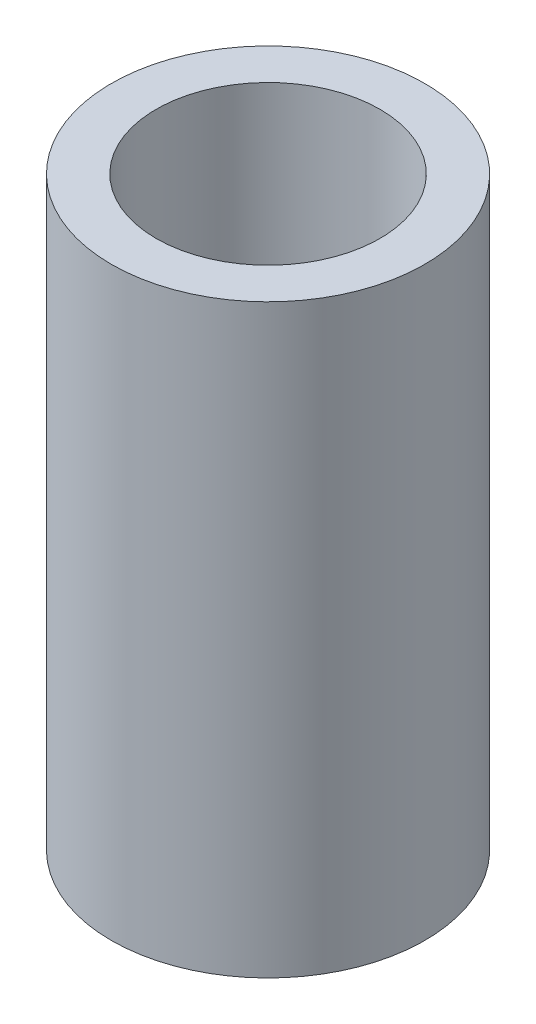
from build123d import *

# Parameters (mm, degrees)
SKETCH1_R           = 2.2225
SKETCH1_R_2         = 1.5875
BOSS_EXTRUDE1_DEPTH = 8.3058


with BuildPart() as part:
    # Sketch1 → Boss-Extrude1 (new body)
    with BuildSketch(Plane(origin=(0, 0, 0), x_dir=(1, 0, 0), z_dir=(0, 1, 0))):
        with Locations(Location((0, 0, 0), (0, 0, 270))):
            Circle(SKETCH1_R)
        with Locations(Location((0, 0, 0), (0, 0, 270))):
            Circle(SKETCH1_R_2, mode=Mode.SUBTRACT)
    extrude(amount=BOSS_EXTRUDE1_DEPTH)


solid = part.part
